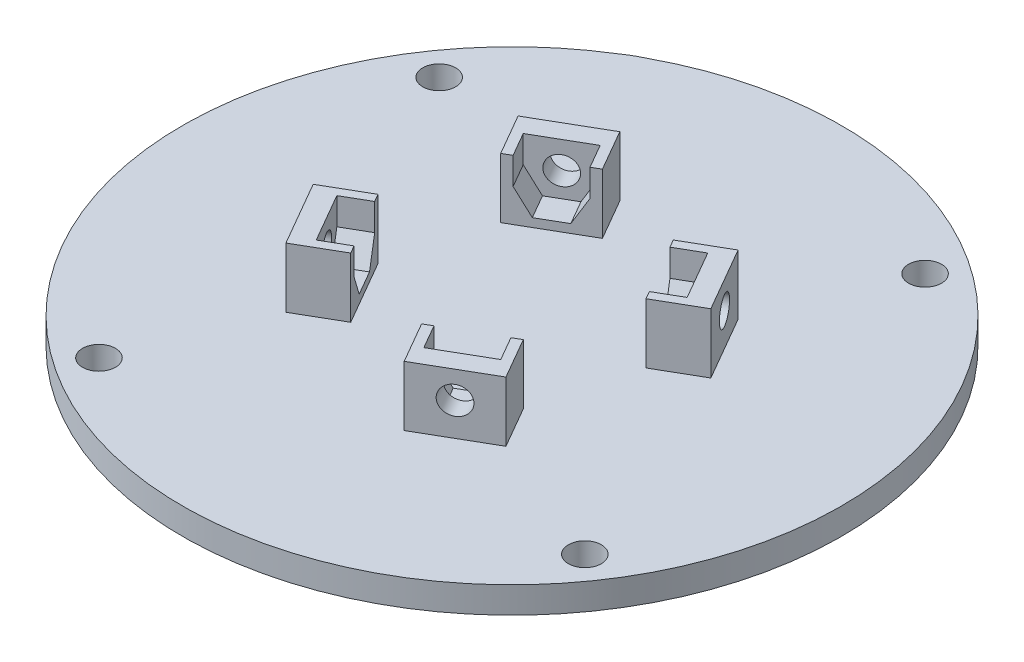
from build123d import *

# Parameters (mm, degrees)
SKETCH1_R           = 50
SKETCH1_R_2         = 1.475
SKETCH1_R_3         = 2.6
BOSS_EXTRUDE1_DEPTH = 4
SKETCH2_R           = 1.5
CUT_EXTRUDE1_DEPTH  = 10
BOSS_EXTRUDE3_DEPTH = 9.1
CIRPATTERN1_COUNT   = 4
CUT_EXTRUDE2_START  = -3
CUT_EXTRUDE2_DEPTH  = 5
CUT_EXTRUDE3_DEPTH  = 15
CIRPATTERN2_COUNT   = 4
CIRPATTERN3_COUNT   = 4
BOSS_EXTRUDE4_START = -4
SKETCH11_R          = 2.6
SKETCH11_R_2        = 1.475
SKETCH11_R_3        = 2.656466029
BOSS_EXTRUDE4_DEPTH = 4
SKETCH12_R          = 2.5
CUT_EXTRUDE4_DEPTH  = 10
CIRPATTERN4_COUNT   = 4


with BuildPart() as part:
    # Sketch1 → Boss-Extrude1 (new body)
    with BuildSketch(Plane(origin=(0, 0, 0), x_dir=(1, 0, 0), z_dir=(0, 1, 0))):
        with Locations(Location((0, 0, 0), (0, 0, 270))):
            Circle(SKETCH1_R)
        with Locations(Location((0, 13, 0), (0, 0, 270))):
            Circle(SKETCH1_R_2, mode=Mode.SUBTRACT)
        with Locations(Location((11.258330249, 6.5, 0), (0, 0, 270))):
            Circle(SKETCH1_R_2, mode=Mode.SUBTRACT)
        with Locations(Location((11.258330249, -6.5, 0), (0, 0, 270))):
            Circle(SKETCH1_R_2, mode=Mode.SUBTRACT)
        with Locations(Location((0, -13, 0), (0, 0, 270))):
            Circle(SKETCH1_R_2, mode=Mode.SUBTRACT)
        with Locations(Location((-11.258330249, -6.5, 0), (0, 0, 270))):
            Circle(SKETCH1_R_2, mode=Mode.SUBTRACT)
        with Locations(Location((-11.258330249, 6.5, 0), (0, 0, 270))):
            Circle(SKETCH1_R_2, mode=Mode.SUBTRACT)
        with Locations(Location((-24.148145657, 6.470476128, 0), (0, 0, 270))):
            Circle(SKETCH1_R_3, mode=Mode.SUBTRACT)
        with Locations(Location((6.470476128, 24.148145657, 0), (0, 0, 270))):
            Circle(SKETCH1_R_3, mode=Mode.SUBTRACT)
        with Locations(Location((24.148145657, -6.470476128, 0), (0, 0, 270))):
            Circle(SKETCH1_R_3, mode=Mode.SUBTRACT)
        with Locations(Location((-6.470476128, -24.148145657, 0), (0, 0, 270))):
            Circle(SKETCH1_R_3, mode=Mode.SUBTRACT)
    extrude(amount=BOSS_EXTRUDE1_DEPTH)

    # Sketch2 → Cut-Extrude1 (cut)
    with BuildSketch(Plane(origin=(0, 4, 0), x_dir=(1, 0, 0), z_dir=(0, 1, 0))):
        with Locations((-25, 43.301270189)):
            Circle(SKETCH2_R)
    extrude(amount=-CUT_EXTRUDE1_DEPTH, mode=Mode.SUBTRACT)

    # Sketch8 → Boss-Extrude3 (add)
    with BuildSketch(Plane(origin=(0, 4, 0), x_dir=(1, 0, 0), z_dir=(0, 1, 0))):
        Polygon((-6.906956469, 23.263199529), (-11.8, 20.438199529), (-8.2, 14.202816622), (-3.306956469, 17.027816622), align=None)
        Polygon((-8.2, 14.202816622), (-11.8, 20.438199529), (-16.693043531, 17.613199529), (-13.093043531, 11.377816622), align=None)
    boss_extrude3 = extrude(amount=BOSS_EXTRUDE3_DEPTH)

    # CirPattern1: Boss-Extrude3 ×4 about axis
    cirpattern1_axis = Axis((0, 0, 0), (0, 1, 0))
    for i in range(1, CIRPATTERN1_COUNT):
        add(boss_extrude3.rotate(cirpattern1_axis, i * 360 / CIRPATTERN1_COUNT))

    # Sketch9 → Cut-Extrude2 (cut)
    with BuildSketch(Plane(origin=(-11.8, 0, -20.438199529), x_dir=(-0.8660254037844384, 0, 0.5000000000000006), z_dir=(-0.5000000000000006, 0, -0.8660254037844384)).offset(CUT_EXTRUDE2_START)):
        Polygon((0, 5.3), (0, 12.7), (-2.136195996, 12.7), (-4.272391992, 9), (-2.136195996, 5.3), align=None)
        Polygon((2.136195996, 12.7), (0, 12.7), (0, 5.3), (2.136195996, 5.3), (4.272391992, 9), align=None)
        Polygon((0, 12.7), (0, 13.1), (-4.272391992, 13.1), (-4.272391992, 9), (-2.136195996, 12.7), align=None)
        Polygon((4.272391992, 13.1), (0, 13.1), (0, 12.7), (2.136195996, 12.7), (4.272391992, 9), align=None)
    cut_extrude2 = extrude(amount=-CUT_EXTRUDE2_DEPTH, mode=Mode.SUBTRACT)

    # Sketch10 → Cut-Extrude3 (cut)
    with BuildSketch(Plane(origin=(-11.8, 0, -20.438199529), x_dir=(-0.8660254037844384, 0, 0.5000000000000006), z_dir=(-0.5000000000000006, 0, -0.8660254037844384))):
        with BuildLine():
            ThreePointArc((2.1, 9), (1.48492424, 10.48492424), (0, 11.1))
            Line((0, 11.1), (0, 6.9))
            ThreePointArc((0, 6.9), (1.48492424, 7.51507576), (2.1, 9))
        make_face()
        with BuildLine():
            Line((0, 6.9), (0, 11.1))
            ThreePointArc((0, 11.1), (-2.1, 9), (0, 6.9))
        make_face()
    cut_extrude3 = extrude(amount=-CUT_EXTRUDE3_DEPTH, mode=Mode.SUBTRACT)

    # CirPattern2: Cut-Extrude2 ×4 about axis
    cirpattern2_axis = Axis((0, 0, 0), (0, 1, 0))
    for i in range(1, CIRPATTERN2_COUNT):
        add(cut_extrude2.rotate(cirpattern2_axis, i * 360 / CIRPATTERN2_COUNT), mode=Mode.SUBTRACT)

    # CirPattern3: Cut-Extrude3 ×4 about axis
    cirpattern3_axis = Axis((0, 4, 0), (0, 1, 0))
    for i in range(1, CIRPATTERN3_COUNT):
        add(cut_extrude3.rotate(cirpattern3_axis, i * 360 / CIRPATTERN3_COUNT), mode=Mode.SUBTRACT)

    # Sketch11 → Boss-Extrude4 (add)
    with BuildSketch(Plane(origin=(0, 4, 0), x_dir=(1, 0, 0), z_dir=(0, 1, 0)).offset(BOSS_EXTRUDE4_START)):
        with Locations((-24.148145657, 6.470476128)):
            Circle(SKETCH11_R)
        with Locations((-6.470476128, -24.148145657)):
            Circle(SKETCH11_R)
        with Locations((0, -13)):
            Circle(SKETCH11_R_2)
        with Locations((-11.258330249, -6.5)):
            Circle(SKETCH11_R_2)
        with Locations((24.148145657, -6.470476128)):
            Circle(SKETCH11_R_3)
        with Locations((6.470476128, 24.148145657)):
            Circle(SKETCH11_R)
        with Locations((0, 13)):
            Circle(SKETCH11_R_2)
        with Locations((11.258330249, 6.5)):
            Circle(SKETCH11_R_2)
        with Locations((11.258330249, -6.5)):
            Circle(SKETCH11_R_2)
        with Locations((-11.258330249, 6.5)):
            Circle(SKETCH11_R_2)
        with BuildLine():
            ThreePointArc((-26.287641956, 42.531868997), (-25.021511025, 43.338528377), (-23.689858044, 44.031700238))
            ThreePointArc((-23.689858044, 44.031700238), (-24.25, 42.002232084), (-26.287641956, 42.531868997))
        make_face()
    extrude(amount=BOSS_EXTRUDE4_DEPTH)

    # Sketch12 → Cut-Extrude4 (cut)
    with BuildSketch(Plane(origin=(0, 4, 0), x_dir=(1, 0, 0), z_dir=(0, 1, 0))):
        with Locations(Location((36.861841993, -25.810939636, 0), (0, 0, 270))):
            Circle(SKETCH12_R)
    cut_extrude4 = extrude(amount=-CUT_EXTRUDE4_DEPTH, mode=Mode.SUBTRACT)

    # CirPattern4: Cut-Extrude4 ×4 about axis
    cirpattern4_axis = Axis((0, 0, 0), (0, 1, 0))
    for i in range(1, CIRPATTERN4_COUNT):
        add(cut_extrude4.rotate(cirpattern4_axis, i * 360 / CIRPATTERN4_COUNT), mode=Mode.SUBTRACT)


solid = part.part
